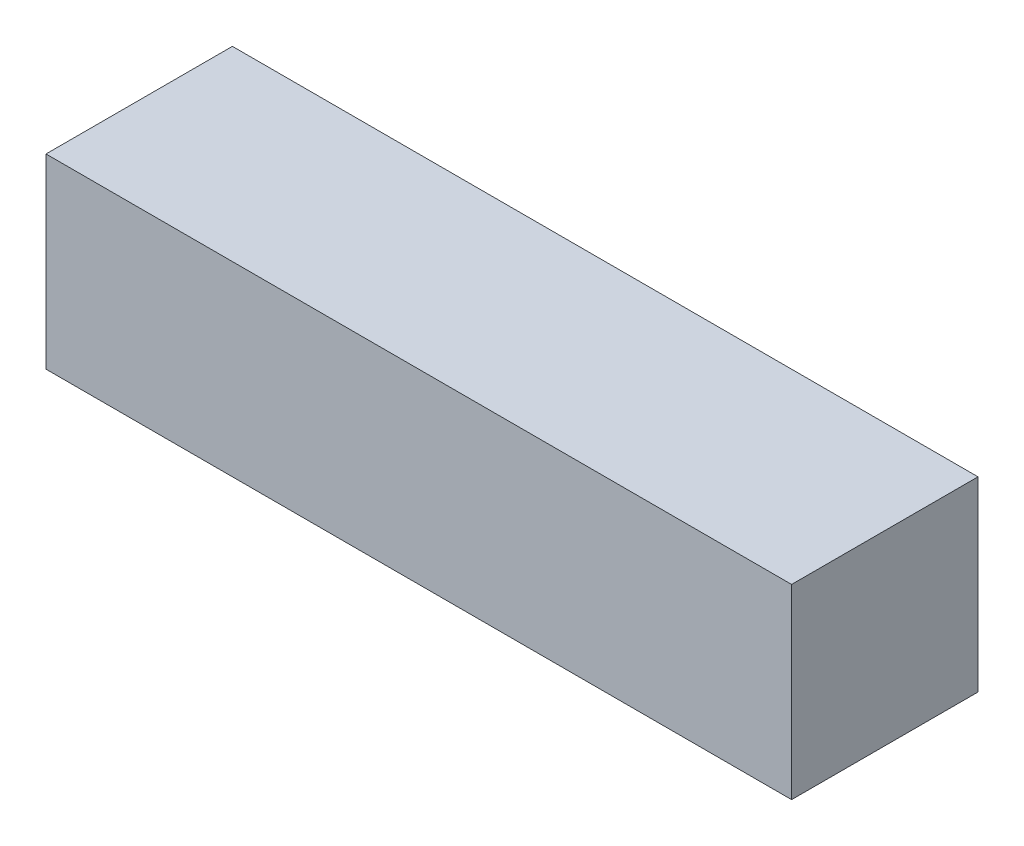
from build123d import *

# Parameters (mm, degrees)
SKETCH1_W           = 140
SKETCH1_H           = 35
BOSS_EXTRUDE1_DEPTH = 35


with BuildPart() as part:
    # Sketch1 → Boss-Extrude1 (new body)
    with BuildSketch(Plane.XY):
        with Locations((70, 17.5)):
            Rectangle(SKETCH1_W, SKETCH1_H)
    extrude(amount=BOSS_EXTRUDE1_DEPTH)


solid = part.part
